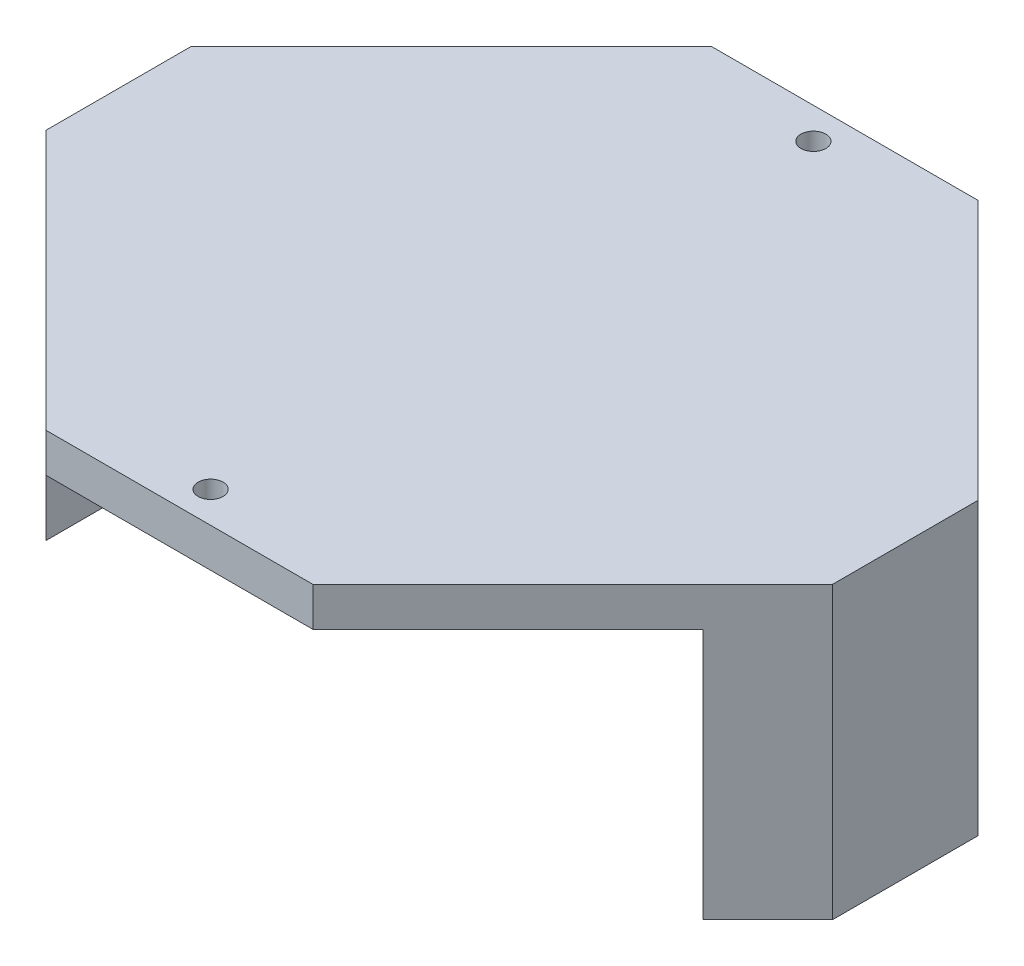
from build123d import *

# Parameters (mm, degrees)
BOSS_EXTRUDE1_DEPTH            = 40.64
F_31_0_12_DIAMETER_HOLE2_D     = 3.048
F_31_0_12_DIAMETER_HOLE2_DEPTH = 12.7
F_31_0_12_DIAMETER_HOLE2_TIP   = 0.915711583
F_31_0_12_DIAMETER_HOLE1_D     = 3.048
F_31_0_12_DIAMETER_HOLE1_DEPTH = 12.7
F_31_0_12_DIAMETER_HOLE1_TIP   = 0.915711583
CHAMFER1_SIZE                  = 31.75


with BuildPart() as part:
    # Sketch1 → Boss-Extrude1 (new, symmetric)
    with BuildSketch(Plane.XY):
        Polygon((48.0568, 17.74825), (-48.0568, 17.74825), (-48.0568, -17.74825), (-40.132, -17.74825), (-40.132, 12.98575), (40.132, 12.98575), (40.132, -17.74825), (48.0568, -17.74825), align=None)
    extrude(amount=BOSS_EXTRUDE1_DEPTH, both=True)

    # #31 (0.12) Diameter Hole2
    with Locations(Plane(origin=(0, -17.74825, 0), x_dir=(-1, 0, 0), z_dir=(0, -1, 0))):
        with Locations((-44.0944, 0), (44.0944, 0)):
            Hole(F_31_0_12_DIAMETER_HOLE2_D / 2, depth=F_31_0_12_DIAMETER_HOLE2_DEPTH)
            with Locations((0, 0, -(F_31_0_12_DIAMETER_HOLE2_DEPTH + F_31_0_12_DIAMETER_HOLE2_TIP / 2))):  # 118° drill point
                Cone(0, F_31_0_12_DIAMETER_HOLE2_D / 2, F_31_0_12_DIAMETER_HOLE2_TIP, mode=Mode.SUBTRACT)

    # #31 (0.12) Diameter Hole1
    with Locations(Plane(origin=(0, 17.74825, 0), x_dir=(1, 0, 0), z_dir=(0, 1, 0))):
        with Locations((0, -36.83), (0, 36.83)):
            Hole(F_31_0_12_DIAMETER_HOLE1_D / 2, depth=F_31_0_12_DIAMETER_HOLE1_DEPTH)
            with Locations((0, 0, -(F_31_0_12_DIAMETER_HOLE1_DEPTH + F_31_0_12_DIAMETER_HOLE1_TIP / 2))):  # 118° drill point
                Cone(0, F_31_0_12_DIAMETER_HOLE1_D / 2, F_31_0_12_DIAMETER_HOLE1_TIP, mode=Mode.SUBTRACT)

    # Chamfer1
    chamfer1_edges = [part.edges().sort_by_distance(p)[0] for p in [
        (-48.0568, 0, 40.64),
        (-48.0568, 0, -40.64),
        (48.0568, 0, -40.64),
        (48.0568, 0, 40.64),
    ]]
    chamfer(chamfer1_edges, length=CHAMFER1_SIZE)


solid = part.part
